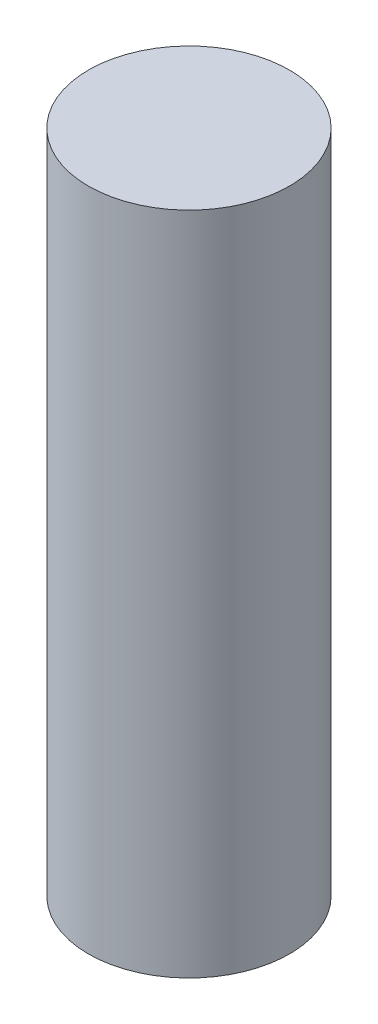
from build123d import *

# Parameters (mm, degrees)
BOSS_EXTRUDE1_DEPTH = 15
SKETCH2_R           = 3.175
BOSS_EXTRUDE2_DEPTH = 6


with BuildPart() as part:
    # Sketch1 → Boss-Extrude1 (new body)
    with BuildSketch(Plane(origin=(0, 0, 0), x_dir=(1, 0, 0), z_dir=(0, 1, 0))):
        with BuildLine():
            Line((-1.710263138, 2.675), (1.710263138, 2.675))
            ThreePointArc((1.710263138, 2.675), (0, -3.175), (-1.710263138, 2.675))
        make_face()
    extrude(amount=BOSS_EXTRUDE1_DEPTH)

    # Sketch2 → Boss-Extrude2 (add)
    with BuildSketch(Plane(origin=(0, 15, 0), x_dir=(1, 0, 0), z_dir=(0, 1, 0))):
        with Locations(Location((0, 0, 0), (0, 0, 57.40715647))):
            Circle(SKETCH2_R)
    extrude(amount=BOSS_EXTRUDE2_DEPTH)


solid = part.part
